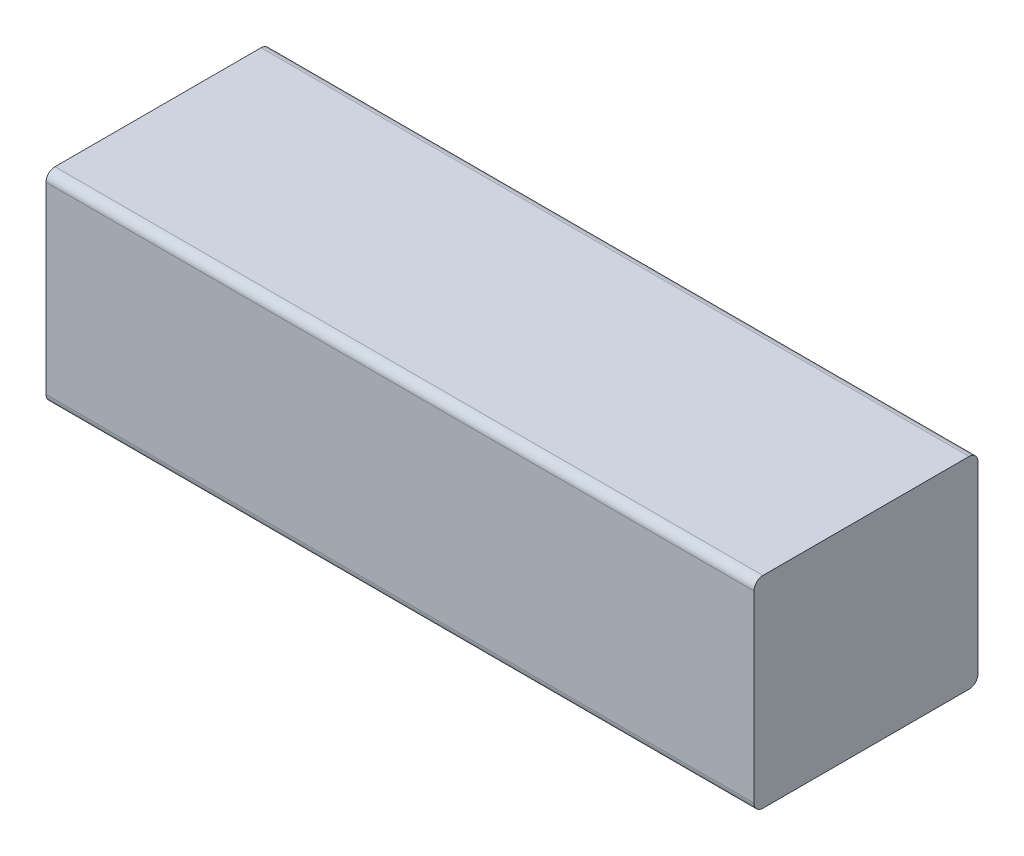
from build123d import *

# Parameters (mm, degrees)
SKETCH_1_W      = 158
SKETCH_1_H      = 45
EXTRUDE_1_DEPTH = 50
FILLET_1_R      = 2


with BuildPart() as part:
    # 草图1 → 凸台-拉伸1 (new body)
    with BuildSketch(Plane.XY):
        with Locations((79, -22.5)):
            Rectangle(SKETCH_1_W, SKETCH_1_H)
    extrude(amount=EXTRUDE_1_DEPTH)

    # 圆角1
    fillet_1_edges = [part.edges().sort_by_distance(p)[0] for p in [
        (79, 0, 50),
        (79, 0, 0),
        (79, -45, 0),
        (79, -45, 50),
    ]]
    fillet(fillet_1_edges, radius=FILLET_1_R)


solid = part.part
